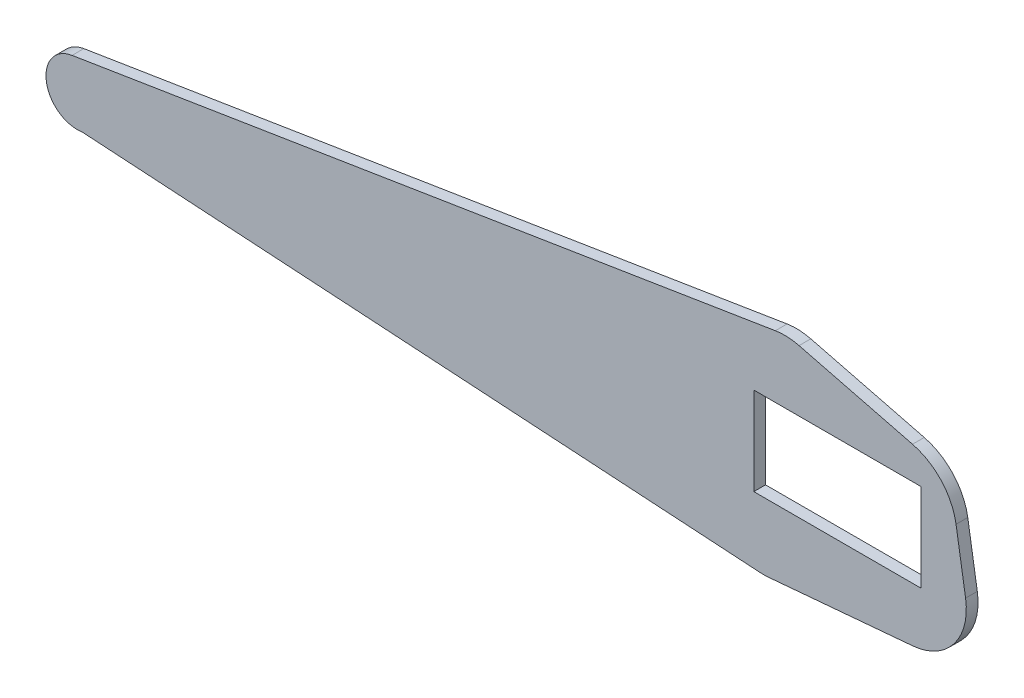
from build123d import *

# Parameters (mm, degrees)
ESBO_O1_W                = 22.8
ESBO_O1_H                = 12
RESSALTO_EXTRUS_O1_DEPTH = 1.6


with BuildPart() as part:
    # Esboço1 → Ressalto-extrusão1 (new body)
    with BuildSketch(Plane.XY):
        with BuildLine():
            Line((-104.371088502, -0.959412185), (-8.45923057, 14.474679896))
            ThreePointArc((-8.45923057, 14.474679896), (-6.836063531, 14.568536185), (-5.227442321, 14.332277754))
            Line((-5.227442321, 14.332277754), (10.244176454, 10.420913457))
            ThreePointArc((10.244176454, 10.420913457), (14.183780118, 8.067281394), (16.181782129, 3.935931872))
            Line((16.181782129, 3.935931872), (17.481460057, -4.140638106))
            ThreePointArc((17.481460057, -4.140638106), (15.894504602, -10.327516352), (10.284415681, -13.380841154))
            Line((10.284415681, -13.380841154), (-9.34255378, -15.108149999))
            ThreePointArc((-9.34255378, -15.108149999), (-9.94330462, -15.138319582), (-10.544624147, -15.123266269))
            Line((-10.544624147, -15.123266269), (-103.02514815, -9.323470085))
            ThreePointArc((-103.02514815, -9.323470085), (-107.880147276, -5.814411311), (-104.371088502, -0.959412185))
        make_face()
        Rectangle(ESBO_O1_W, ESBO_O1_H, mode=Mode.SUBTRACT)
    extrude(amount=RESSALTO_EXTRUS_O1_DEPTH)


solid = part.part
